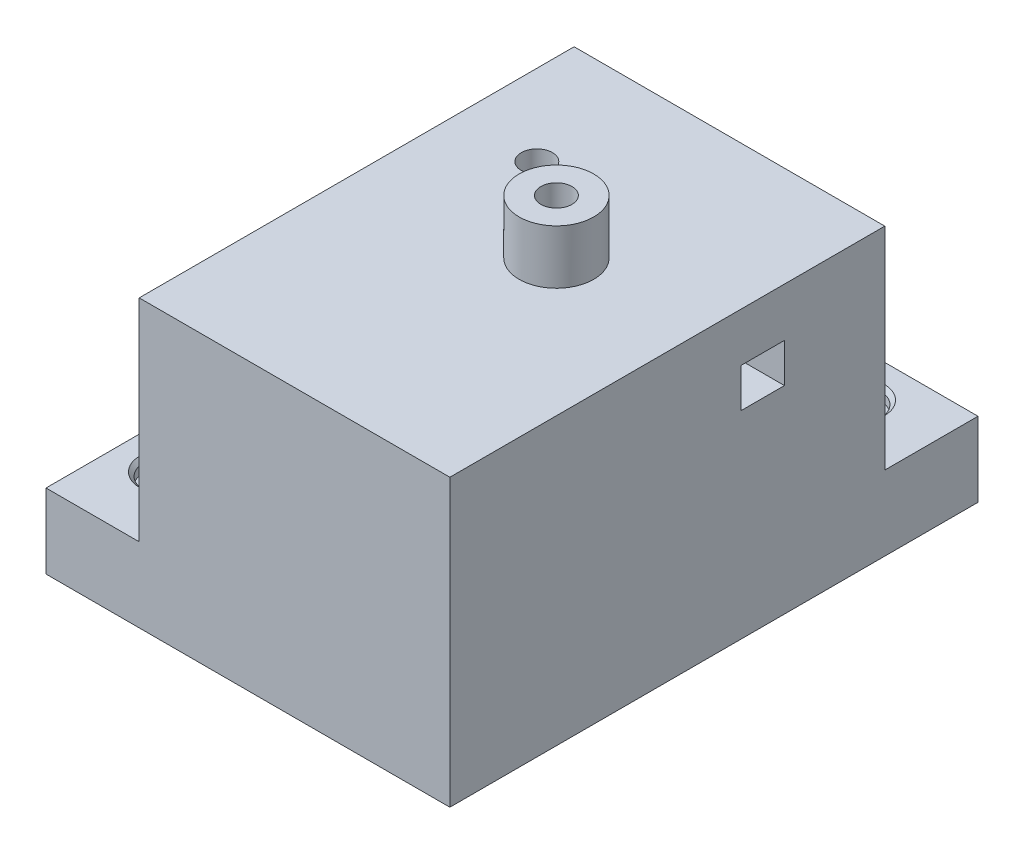
from build123d import *

# Parameters (mm, degrees)
SKETCH1_W                                   = 50
SKETCH1_H                                   = 70
BOSS_EXTRUDE1_DEPTH                         = 46
SKETCH2_R                                   = 3.15
CUT_EXTRUDE1_DEPTH                          = 10
CUT_EXTRUDE2_DEPTH                          = 30
SKETCH4_R                                   = 2.5
CUT_EXTRUDE3_DEPTH                          = 10
SKETCH5_W                                   = 70
SKETCH5_H                                   = 12
BOSS_EXTRUDE2_DEPTH                         = 15
SKETCH6_W                                   = 65
SKETCH6_H                                   = 12
BOSS_EXTRUDE3_DEPTH                         = 15
SKETCH7_W                                   = 65
SKETCH7_H                                   = 12
BOSS_EXTRUDE4_DEPTH                         = 15
SKETCH8_W                                   = 100
SKETCH8_H                                   = 12
BOSS_EXTRUDE5_DEPTH                         = 15
CUT_EXTRUDE4_DEPTH                          = 15
SKETCH10_W                                  = 65
SKETCH10_H                                  = 12
BOSS_EXTRUDE6_DEPTH                         = 15
SKETCH11_W                                  = 65
SKETCH11_H                                  = 15
CUT_EXTRUDE5_DEPTH                          = 15
CBORE_FOR_5_BINDING_HEAD_MACHINE_SC_2_COUNT = 2
CBORE_FOR_5_BINDING_HEAD_MACHINE_SC_2_PITCH = 45.5
CBORE_FOR_5_BINDING_HEAD_MACHINE_SC_3_COUNT = 2
CBORE_FOR_5_BINDING_HEAD_MACHINE_SC_3_PITCH = 79.7527429
SKETCH15_R                                  = 3.15
BOSS_EXTRUDE7_DEPTH                         = 10
BOSS_EXTRUDE8_START                         = 8.7
SKETCH16_R                                  = 6
SKETCH16_R_2                                = 2.5
BOSS_EXTRUDE8_DEPTH                         = 8.7
CUT_EXTRUDE6_DEPTH                          = 2


with BuildPart() as part:
    # Sketch1 → Boss-Extrude1 (new body)
    with BuildSketch(Plane(origin=(0, 0, 0), x_dir=(1, 0, 0), z_dir=(0, 1, 0))):
        with Locations((-25, -36.963350785)):
            Rectangle(SKETCH1_W, SKETCH1_H)
    extrude(amount=BOSS_EXTRUDE1_DEPTH)

    # Sketch2 → Cut-Extrude1 (cut)
    with BuildSketch(Plane.XY.offset(71.963350785)):
        with Locations((-25, 35)):
            Circle(SKETCH2_R)
    extrude(amount=-CUT_EXTRUDE1_DEPTH, mode=Mode.SUBTRACT)

    # Sketch3 → Cut-Extrude2 (cut)
    with BuildSketch(Plane(origin=(0, 0, 0), x_dir=(0, 0, -1), z_dir=(1, 0, 0))):
        Polygon((-21.963350785, 38.15), (-25.113350785, 38.15), (-25.113350785, 31.85), (-18.113350785, 31.85), (-18.113350785, 38.15), align=None)
    extrude(amount=-CUT_EXTRUDE2_DEPTH, mode=Mode.SUBTRACT)

    # Sketch4 → Cut-Extrude3 (cut)
    with BuildSketch(Plane(origin=(0, 46, 0), x_dir=(1, 0, 0), z_dir=(0, 1, 0))):
        with Locations(Location((-22, -32.813350785, 0), (0, 0, 270))):
            Circle(SKETCH4_R)
        with Locations(Location((-37, -20.963350785, 0), (0, 0, 270))):
            Circle(SKETCH4_R)
    extrude(amount=-CUT_EXTRUDE3_DEPTH, mode=Mode.SUBTRACT)

    # Sketch5 → Boss-Extrude2 (add)
    with BuildSketch(Plane(origin=(0, 0, 0), x_dir=(0, 0, -1), z_dir=(1, 0, 0))):
        with Locations((-36.963350785, 6)):
            Rectangle(SKETCH5_W, SKETCH5_H)
    extrude(amount=BOSS_EXTRUDE2_DEPTH)

    # Sketch6 → Boss-Extrude3 (add)
    with BuildSketch(Plane(origin=(0, 0, 1.963350785), x_dir=(-1, 0, 0), z_dir=(0, 0, -1))):
        with Locations((17.5, 6)):
            Rectangle(SKETCH6_W, SKETCH6_H)
    extrude(amount=BOSS_EXTRUDE3_DEPTH)

    # Sketch7 → Boss-Extrude4 (add)
    with BuildSketch(Plane.XY.offset(71.963350785)):
        with Locations((-17.5, 6)):
            Rectangle(SKETCH7_W, SKETCH7_H)
    extrude(amount=BOSS_EXTRUDE4_DEPTH)

    # Sketch8 → Boss-Extrude5 (add)
    with BuildSketch(Plane.ZY.offset(50)):
        with Locations((36.963350785, 6)):
            Rectangle(SKETCH8_W, SKETCH8_H)
    extrude(amount=BOSS_EXTRUDE5_DEPTH)

    # Sketch9 → Cut-Extrude4 (cut)
    with BuildSketch(Plane(origin=(0, 12, 0), x_dir=(1, 0, 0), z_dir=(0, 1, 0))):
        Polygon((15, 13.036649215), (-65, 13.036649215), (-65, -1.963350785), (0, -1.963350785), (0, -86.963350785), (15, -86.963350785), (15, -1.963350785), align=None)
    extrude(amount=-CUT_EXTRUDE4_DEPTH, mode=Mode.SUBTRACT)

    # Sketch10 → Boss-Extrude6 (add)
    with BuildSketch(Plane(origin=(0, 0, 1.963350785), x_dir=(-1, 0, 0), z_dir=(0, 0, -1))):
        with Locations((32.5, 6)):
            Rectangle(SKETCH10_W, SKETCH10_H)
    extrude(amount=BOSS_EXTRUDE6_DEPTH)

    # Sketch11 → Cut-Extrude5 (cut)
    with BuildSketch(Plane(origin=(0, 12, 0), x_dir=(1, 0, 0), z_dir=(0, 1, 0))):
        with Locations((-32.5, -79.463350785)):
            Rectangle(SKETCH11_W, SKETCH11_H)
    extrude(amount=-CUT_EXTRUDE5_DEPTH, mode=Mode.SUBTRACT)

    # Sketch14 → CBORE for #5 Binding Head Machine Screw1 (revolve, cut)
    with BuildSketch(Plane(origin=(-12, 12, -5.536649215), x_dir=(0, 0, 1), z_dir=(1, 0, 0))):
        Polygon((0, 0), (0, 12), (1.7272, 12), (1.7272, 1.9812), (3.77063, 1.9812), (3.77063, 0.635), (4.40563, 0), align=None)
    cbore_for_5_binding_head_machine_screw1 = revolve(axis=Axis((-12, 18.35, -5.536649215), (0, -1, 0)), mode=Mode.SUBTRACT)

    # CBORE for _5 Binding Head Machine Sc 2: CBORE for #5 Binding Head Machine Screw1 ×2
    with Locations(*[(-i * CBORE_FOR_5_BINDING_HEAD_MACHINE_SC_2_PITCH, 0, 0) for i in range(1, CBORE_FOR_5_BINDING_HEAD_MACHINE_SC_2_COUNT)]):
        add(cbore_for_5_binding_head_machine_screw1, mode=Mode.SUBTRACT)

    # CBORE for _5 Binding Head Machine Sc 3: CBORE for #5 Binding Head Machine Screw1 ×2
    with Locations(*[Vector(-0.5705132932833948, 0, 0.821288367254118) * (i * CBORE_FOR_5_BINDING_HEAD_MACHINE_SC_3_PITCH) for i in range(1, CBORE_FOR_5_BINDING_HEAD_MACHINE_SC_3_COUNT)]):
        add(cbore_for_5_binding_head_machine_screw1, mode=Mode.SUBTRACT)

    # Sketch15 → Boss-Extrude7 (add)
    with BuildSketch(Plane.XY.offset(71.963350785)):
        with Locations((-25, 35)):
            Circle(SKETCH15_R)
    extrude(amount=-BOSS_EXTRUDE7_DEPTH)

    # Sketch16 → Boss-Extrude8 (add)
    with BuildSketch(Plane(origin=(0, 46, 0), x_dir=(1, 0, 0), z_dir=(0, 1, 0)).offset(BOSS_EXTRUDE8_START)):
        with Locations(Location((-22, -32.813350785, 0), (0, 0, 90))):
            Circle(SKETCH16_R)
        with Locations(Location((-22, -32.813350785, 0), (0, 0, 270))):
            Circle(SKETCH16_R_2, mode=Mode.SUBTRACT)
    extrude(amount=-BOSS_EXTRUDE8_DEPTH)

    # Sketch17 → Cut-Extrude6 (cut)
    # profile 1 of 2: a face of its own
    with BuildSketch(Plane.ZY.offset(50)):
        with BuildLine():
            Line((4.371764932, 16.80012963), (4.057662368, 16.80012963))
            add(Edge.make_bspline(
                [(4.057662368, 16.80012963), (4.059709521, 16.841800518), (4.063730075, 16.923641032), (4.082558365, 17.042964939), (4.109499242, 17.157019737), (4.147590696, 17.264889651), (4.194896974, 17.367528458), (4.251627001, 17.464528474), (4.318820852, 17.555519663), (4.395027586, 17.639658506), (4.477796225, 17.716846077), (4.567102164, 17.78350132), (4.660947191, 17.839818991), (4.75904659, 17.886900233), (4.862507154, 17.922240079), (4.970390012, 17.948461718), (5.083169148, 17.964238064), (5.16000917, 17.96593385), (5.19908865, 17.966796296)],
                knots=[0, 0, 0, 0, 1.10065271, 2.161652631, 3.183658789, 4.190468796, 5.17591951, 6.163126047, 7.15150782, 8.156236427, 9.156009102, 10.134482811, 11.092018607, 12.041330605, 13.001268258, 13.972401359, 14.968799086, 16, 16, 16, 16], degree=3))
            add(Edge.make_bspline(
                [(5.19908865, 17.966796296), (5.237466725, 17.96589784), (5.312878269, 17.964132405), (5.422940284, 17.948971376), (5.527717578, 17.925225784), (5.627005345, 17.891910368), (5.720011409, 17.847125941), (5.807434454, 17.793328402), (5.890315265, 17.731108571), (5.964922048, 17.657854757), (6.033430127, 17.579652373), (6.092532383, 17.496164469), (6.143145546, 17.409935183), (6.185333226, 17.320306982), (6.216389365, 17.226435953), (6.239967573, 17.129688751), (6.253294987, 17.02906394), (6.25534041, 16.960957384), (6.256380317, 16.926331553)],
                knots=[0, 0, 0, 0, 1.111607364, 2.184268762, 3.212621178, 4.221274766, 5.211760367, 6.196651075, 7.1921475, 8.207485113, 9.220403448, 10.201281604, 11.166441695, 12.114753415, 13.065576456, 14.026450734, 14.996634279, 16, 16, 16, 16], degree=3))
            add(Edge.make_bspline(
                [(6.256380317, 16.926331553), (6.254687054, 16.877583718), (6.251330243, 16.780943505), (6.222615866, 16.638928642), (6.177769355, 16.501335223), (6.123771998, 16.390597921), (6.069299554, 16.301364427), (6.020212047, 16.227895722), (5.962747236, 16.148790254), (5.896068738, 16.064312916), (5.821555866, 15.973802011), (5.738533702, 15.877312216), (5.64641022, 15.775840446), (5.581751719, 15.706534845), (5.548247304, 15.670622418)],
                knots=[0, 0, 0, 0, 1.184426356, 2.348067706, 3.509069118, 4.696110526, 5.333549288, 6.050745305, 6.844228056, 7.710549037, 8.667450064, 9.695053472, 10.805634456, 12, 12, 12, 12], degree=3))
            Line((5.548247304, 15.670622418), (4.672546182, 14.736027066))
            Line((4.672546182, 14.736027066), (6.301252112, 14.736027066))
            Line((6.301252112, 14.736027066), (6.301252112, 14.377052707))
            Line((6.301252112, 14.377052707), (3.923046984, 14.377052707))
            Line((3.923046984, 14.377052707), (5.280418779, 15.825570335))
            add(Edge.make_bspline(
                [(5.280418779, 15.825570335), (5.313466665, 15.860068641), (5.376944893, 15.926332828), (5.466727469, 16.023075788), (5.547366458, 16.112825329), (5.61938385, 16.195411877), (5.681217356, 16.272043445), (5.736089588, 16.340238149), (5.780055179, 16.402992599), (5.827770574, 16.475733213), (5.873984556, 16.56454553), (5.913696912, 16.673079219), (5.93791176, 16.784806472), (5.940816596, 16.860308509), (5.942277753, 16.898286681)],
                knots=[0, 0, 0, 0, 1.329631726, 2.553950428, 3.673215718, 4.687767853, 5.603093632, 6.413772471, 7.123043292, 7.734684054, 8.834405432, 9.900288307, 10.943827018, 12, 12, 12, 12], degree=3))
            add(Edge.make_bspline(
                [(5.942277753, 16.898286681), (5.941642011, 16.922168079), (5.940389085, 16.96923373), (5.929331387, 17.038239489), (5.912620881, 17.104804303), (5.888675623, 17.169132922), (5.857068883, 17.230578574), (5.818595503, 17.289216054), (5.77420544, 17.345905019), (5.72285417, 17.399058317), (5.66644265, 17.447739523), (5.606848401, 17.490863608), (5.543798297, 17.526902719), (5.477558174, 17.556446216), (5.408312705, 17.579621597), (5.33592796, 17.595680177), (5.260603944, 17.605762661), (5.209170448, 17.607126833), (5.182962849, 17.607821937)],
                knots=[0, 0, 0, 0, 0.991446411, 1.95395049, 2.89581595, 3.838931463, 4.798493298, 5.75982156, 6.748411868, 7.785213223, 8.824556874, 9.840280684, 10.836137867, 11.835679398, 12.848801643, 13.863922112, 14.911575587, 16, 16, 16, 16], degree=3))
            add(Edge.make_bspline(
                [(5.182962849, 17.607821937), (5.155592016, 17.607106905), (5.10184022, 17.6057027), (5.022921187, 17.595880036), (4.94763541, 17.578934196), (4.875793507, 17.555757521), (4.807273921, 17.526298972), (4.742409877, 17.489607228), (4.681346988, 17.445823734), (4.623970464, 17.396183178), (4.571106485, 17.340915577), (4.524659609, 17.279305614), (4.484075595, 17.212478198), (4.448666362, 17.140613648), (4.419910672, 17.063059868), (4.397937521, 16.980092163), (4.380550674, 16.892070782), (4.374742154, 16.831285697), (4.371764932, 16.80012963)],
                knots=[0, 0, 0, 0, 1.031018746, 2.02475058, 2.990194455, 3.934040569, 4.864654155, 5.795059489, 6.735614925, 7.690564532, 8.649604399, 9.611025574, 10.590972636, 11.591080095, 12.624614302, 13.701020113, 14.821632451, 16, 16, 16, 16], degree=3))
        make_face()
    # profile 2 of 2: a face of its own
    with BuildSketch(Plane.ZY.offset(50)):
        with BuildLine():
            Line((7.378175189, 14.287309117), (7.127173586, 14.461888444))
            Line((7.127173586, 14.461888444), (8.100330638, 15.884464566))
            add(Edge.make_bspline(
                [(8.100330638, 15.884464566), (8.038239902, 15.876871502), (7.915979782, 15.861920337), (7.79284268, 15.859173683), (7.732241695, 15.857821937)],
                knots=[0, 0, 0, 0, 1.015715272, 2, 2, 2, 2], degree=3))
            add(Edge.make_bspline(
                [(7.732241695, 15.857821937), (7.695499647, 15.858763014), (7.623378221, 15.860610265), (7.517346568, 15.875252073), (7.415461008, 15.897802201), (7.317991652, 15.931450956), (7.224572147, 15.973269165), (7.135406433, 16.025126179), (7.050614543, 16.08613247), (6.971107133, 16.155965462), (6.898795394, 16.232643514), (6.834372096, 16.313799157), (6.780830964, 16.400375128), (6.736354379, 16.490605347), (6.702623925, 16.585786698), (6.678061388, 16.684836098), (6.662939033, 16.78844774), (6.661139938, 16.858972871), (6.660226471, 16.894781072)],
                knots=[0, 0, 0, 0, 1.060718605, 2.082097864, 3.085795603, 4.069760067, 5.054557537, 6.03741023, 7.043284206, 8.066802108, 9.088538119, 10.083643548, 11.053783639, 12.022749082, 12.983451788, 13.964007469, 14.966251758, 16, 16, 16, 16], degree=3))
            add(Edge.make_bspline(
                [(6.660226471, 16.894781072), (6.661960906, 16.943749725), (6.665365249, 17.039865256), (6.692763767, 17.180299025), (6.737824106, 17.313085569), (6.800652483, 17.437875763), (6.879787204, 17.552874502), (6.974895794, 17.656483111), (7.085399758, 17.747227965), (7.208781778, 17.825232043), (7.342134798, 17.88796704), (7.481803456, 17.93420634), (7.626717576, 17.961405088), (7.724885247, 17.964990949), (7.774309003, 17.966796296)],
                knots=[0, 0, 0, 0, 1.022988612, 2.007919123, 2.978103895, 3.94594894, 4.918897164, 5.887013414, 6.875921846, 7.89917871, 8.930658928, 9.948724884, 10.967259574, 12, 12, 12, 12], degree=3))
            add(Edge.make_bspline(
                [(7.774309003, 17.966796296), (7.822797423, 17.964966133), (7.918605969, 17.961349904), (8.059494976, 17.934865935), (8.194435993, 17.890229262), (8.32268098, 17.828544698), (8.441420392, 17.75122379), (8.548196203, 17.659089267), (8.640571742, 17.552083739), (8.718395623, 17.432795249), (8.780865663, 17.304628268), (8.825937946, 17.170844346), (8.853683585, 17.032405624), (8.857179912, 16.93861115), (8.85894442, 16.891275463)],
                knots=[0, 0, 0, 0, 1.026385292, 2.028040595, 3.023318987, 4.028184125, 5.03290303, 6.015178782, 7.004435299, 8.016004309, 9.023023918, 10.015172535, 10.998308025, 12, 12, 12, 12], degree=3))
            add(Edge.make_bspline(
                [(8.85894442, 16.891275463), (8.857766011, 16.854531696), (8.855375903, 16.780006155), (8.838639596, 16.666775812), (8.810219411, 16.551324583), (8.777967712, 16.453602987), (8.746835544, 16.372894537), (8.717534413, 16.309142957), (8.685022259, 16.242041694), (8.647103494, 16.172294356), (8.606341197, 16.099011821), (8.56028192, 16.022929106), (8.509976349, 15.943944112), (8.474146629, 15.890697024), (8.455799388, 15.863430912)],
                knots=[0, 0, 0, 0, 1.179839688, 2.393009684, 3.667231171, 4.993948276, 5.694988576, 6.444077775, 7.246288328, 8.089075292, 8.993003841, 9.939041771, 10.944649915, 12, 12, 12, 12], degree=3))
            Line((8.455799388, 15.863430912), (7.378175189, 14.287309117))
        make_face()
        with BuildLine():
            add(Edge.make_bspline(
                [(7.790434804, 16.216796296), (7.818268818, 16.21755668), (7.872452181, 16.219036889), (7.95182948, 16.228046131), (8.026753684, 16.244020117), (8.097424933, 16.266939829), (8.164551835, 16.294596498), (8.227068163, 16.329808484), (8.285026239, 16.371825119), (8.338814166, 16.419035135), (8.386578165, 16.471485718), (8.429121196, 16.526382825), (8.465281763, 16.583967435), (8.493845041, 16.644960697), (8.517329616, 16.707877905), (8.533547628, 16.773732261), (8.542531961, 16.842180661), (8.544063536, 16.888679319), (8.544841856, 16.912309117)],
                knots=[0, 0, 0, 0, 1.163407946, 2.26475976, 3.333800367, 4.359385343, 5.366239384, 6.363380779, 7.350133999, 8.353570782, 9.349036268, 10.310270964, 11.253520213, 12.184142, 13.120487599, 14.056272588, 15.012232024, 16, 16, 16, 16], degree=3))
            add(Edge.make_bspline(
                [(8.544841856, 16.912309117), (8.544172186, 16.935948782), (8.542852521, 16.982533642), (8.532265221, 17.051083382), (8.513639998, 17.116776643), (8.488649514, 17.179973073), (8.455729276, 17.240153445), (8.41622579, 17.298073316), (8.36929334, 17.353365444), (8.315290774, 17.404729428), (8.257056221, 17.452077327), (8.194995721, 17.493863403), (8.129620805, 17.528884599), (8.061330315, 17.557783569), (7.989981966, 17.580335345), (7.915617978, 17.59655271), (7.837862572, 17.605524464), (7.785081286, 17.607046359), (7.758183202, 17.607821937)],
                knots=[0, 0, 0, 0, 0.972161553, 1.915763587, 2.844109794, 3.775983486, 4.705125789, 5.659731448, 6.655561913, 7.682237399, 8.721216875, 9.739758359, 10.754845918, 11.767244016, 12.7857855, 13.828538656, 14.893392813, 16, 16, 16, 16], degree=3))
            add(Edge.make_bspline(
                [(7.758183202, 17.607821937), (7.731519048, 17.607045106), (7.679204199, 17.605520968), (7.60214004, 17.596569763), (7.528278872, 17.580226279), (7.457137251, 17.557794015), (7.388848791, 17.528882444), (7.323476958, 17.493861568), (7.261401941, 17.452086946), (7.203223221, 17.404692173), (7.149125299, 17.353604527), (7.10299977, 17.297831098), (7.063405878, 17.240183574), (7.030530875, 17.179965066), (7.005528357, 17.11677878), (6.986906356, 17.051082803), (6.976318191, 16.982533793), (6.974998644, 16.935948833), (6.974329035, 16.912309117)],
                knots=[0, 0, 0, 0, 1.099389452, 2.15699305, 3.192601482, 4.213358962, 5.227959689, 6.245255729, 7.266013209, 8.307253147, 9.336162325, 10.327954924, 11.284637477, 12.215801273, 13.149702402, 14.080068371, 15.025723358, 16, 16, 16, 16], degree=3))
            add(Edge.make_bspline(
                [(6.974329035, 16.912309117), (6.974934961, 16.888660918), (6.976129958, 16.842022342), (6.987657748, 16.773495949), (7.006936028, 16.707807755), (7.032755418, 16.644319048), (7.066757009, 16.58364719), (7.108480857, 16.526079828), (7.157386403, 16.470964378), (7.21281989, 16.419157166), (7.273488051, 16.371604991), (7.338284797, 16.330074609), (7.406094634, 16.295002164), (7.477156265, 16.26686078), (7.550943065, 16.244249117), (7.628118196, 16.228075571), (7.708426434, 16.219123305), (7.762836416, 16.217579408), (7.790434804, 16.216796296)],
                knots=[0, 0, 0, 0, 0.952633368, 1.87876736, 2.791047057, 3.707742249, 4.635551637, 5.587206343, 6.568248508, 7.601284464, 8.641511608, 9.671105535, 10.699146789, 11.713763218, 12.747829548, 13.806491675, 14.887386225, 16, 16, 16, 16], degree=3))
        make_face(mode=Mode.SUBTRACT)
    extrude(amount=-CUT_EXTRUDE6_DEPTH, mode=Mode.SUBTRACT)


solid = part.part
